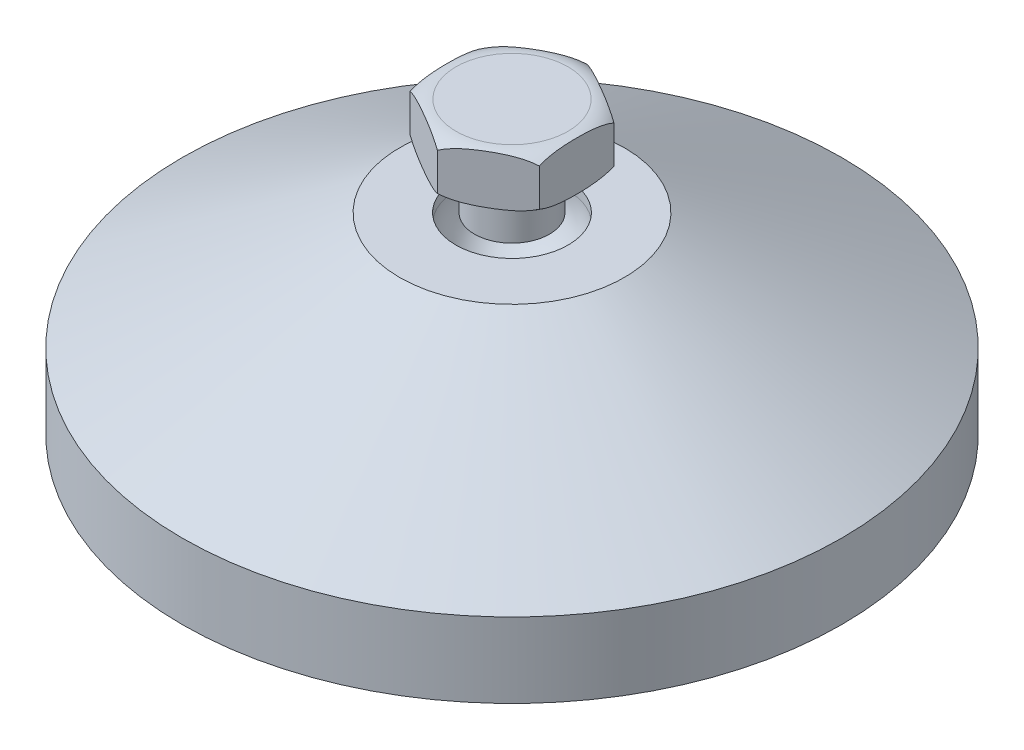
from build123d import *

# Parameters (mm, degrees)
SKETCH7_W      = 4
SKETCH7_H      = 5
EXTRUDE3_DEPTH = 5.5


with BuildPart() as part:
    # Sketch1 → Revolve1 (revolve)
    with BuildSketch(Plane.XY, mode=Mode.PRIVATE) as revolve1_sk:
        with BuildLine():
            Line((35.2, 0), (35.2, 8))
            Line((35.2, 8), (12, 20.5))
            Line((12, 20.5), (6, 20.5))
            Line((6, 20.5), (6, 19.5))
            ThreePointArc((6, 19.5), (4.208099244, 15.437980798), (0, 14.022774425))
            Line((0, 14.022774425), (0, 2.5))
            Line((0, 2.5), (3.75, 2.5))
            Line((3.75, 2.5), (3.75, 0))
            Line((3.75, 0), (35.2, 0))
        make_face()
    revolve(revolve1_sk.sketch.rotate(Axis((0, 280.708212389, 0), (0, -1, 0)), 90), axis=Axis((0, 280.708212389, 0), (0, -1, 0)))


with BuildPart() as body_2:
    # Sketch7 → Revolve2 (revolve)
    with BuildSketch(Plane.XY, mode=Mode.PRIVATE) as revolve2_sk:
        with Locations((2, 23)):
            Rectangle(SKETCH7_W, SKETCH7_H)
    revolve(revolve2_sk.sketch.rotate(Axis((0, 25.5, 0), (0, -1, 0)), 90), axis=Axis((0, 25.5, 0), (0, -1, 0)))

    # Sketch8 → Extrude3 (add)
    with BuildSketch(Plane(origin=(0, 25.5, 0), x_dir=(1, 0, 0), z_dir=(0, 1, 0))):
        Polygon((0, 7.967433715), (-6.9, 3.983716857), (-6.9, -3.983716857), (0, -7.967433715), (6.9, -3.983716857), (6.9, 3.983716857), align=None)
    extrude(amount=EXTRUDE3_DEPTH)

    # Sketch10 → Cut-Revolve1 (revolve, cut)
    with BuildSketch(Plane(origin=(0, 0, 0), x_dir=(0, 0, -1), z_dir=(1, 0, 0)), mode=Mode.PRIVATE) as cut_revolve1_sk:
        with BuildLine():
            Line((-7.967433715, 31), (-7.967433715, 30.25))
            ThreePointArc((-7.967433715, 30.25), (-7.039765119, 30.806287317), (-5.975575286, 31))
            Line((-5.975575286, 31), (-7.967433715, 31))
        make_face()
        with BuildLine():
            Line((-7.967433715, 25.5), (-5.975575286, 25.5))
            ThreePointArc((-5.975575286, 25.5), (-7.039765119, 25.693712683), (-7.967433715, 26.25))
            Line((-7.967433715, 26.25), (-7.967433715, 25.5))
        make_face()
    revolve(cut_revolve1_sk.sketch.rotate(Axis((0, 31, 0), (0, 1, 0)), 180), axis=Axis((0, 31, 0), (0, 1, 0)), mode=Mode.SUBTRACT)


solid = Compound([part.part, body_2.part])
